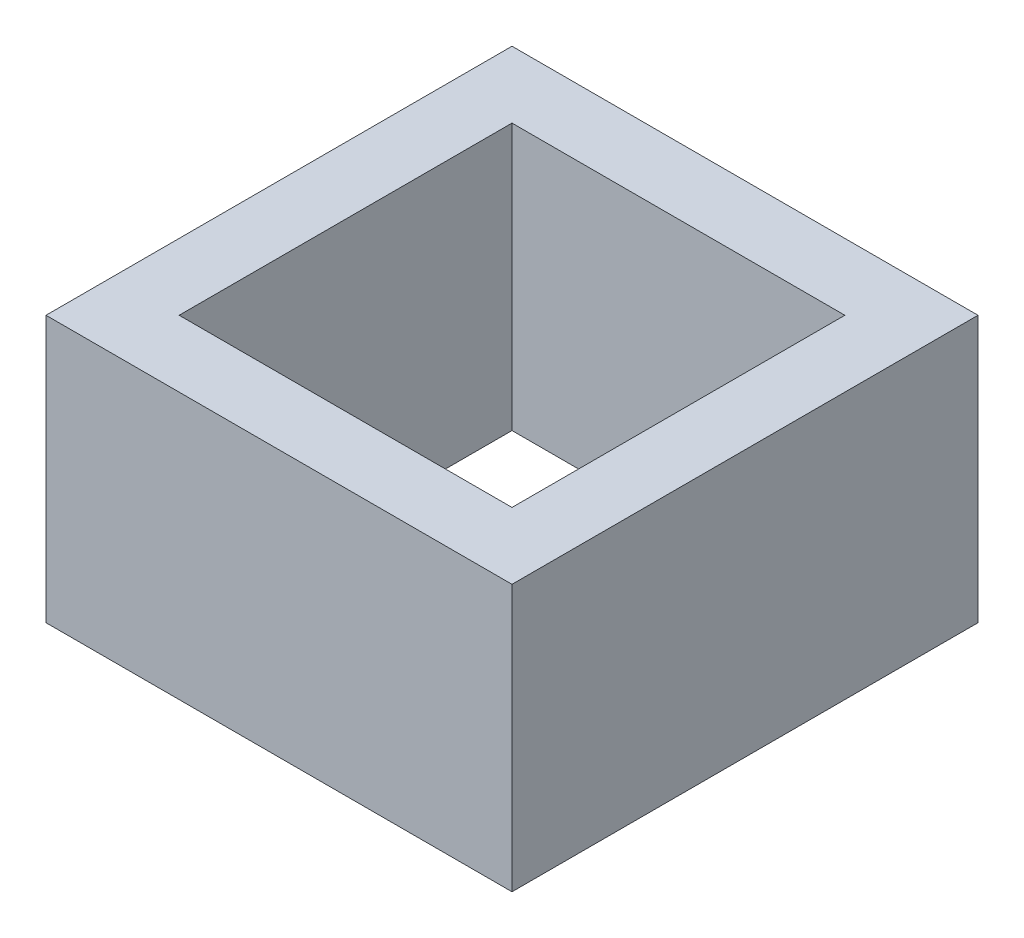
from build123d import *

# Parameters (mm, degrees)
SKETCH1_W           = 35
SKETCH1_H           = 35
SKETCH1_W_2         = 25
SKETCH1_H_2         = 25
BOSS_EXTRUDE1_DEPTH = 20


with BuildPart() as part:
    # Sketch1 → Boss-Extrude1 (new body)
    with BuildSketch(Plane(origin=(0, 0, 0), x_dir=(1, 0, 0), z_dir=(0, 1, 0))):
        Rectangle(SKETCH1_W, SKETCH1_H)
        Rectangle(SKETCH1_W_2, SKETCH1_H_2, mode=Mode.SUBTRACT)
    extrude(amount=BOSS_EXTRUDE1_DEPTH)


solid = part.part
